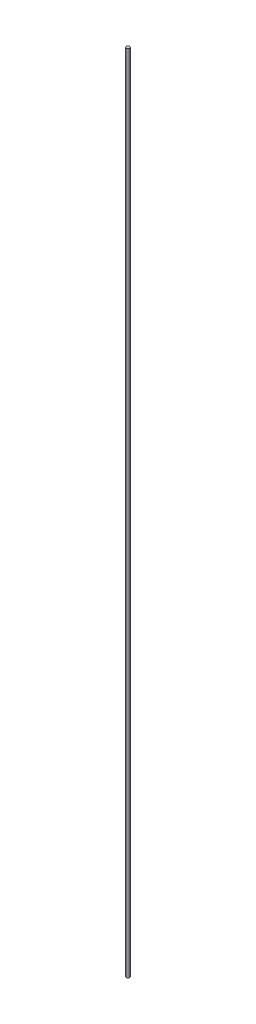
from build123d import *

# Parameters (mm, degrees)
SKETCH1_R           = 1
BOSS_EXTRUDE1_DEPTH = 493.5


with BuildPart() as part:
    # Sketch1 → Boss-Extrude1 (new body)
    with BuildSketch(Plane(origin=(0, 0, 0), x_dir=(1, 0, 0), z_dir=(0, 1, 0))):
        with Locations(Location((0, 0, 0), (0, 0, 270))):
            Circle(SKETCH1_R)
    extrude(amount=BOSS_EXTRUDE1_DEPTH)


solid = part.part
